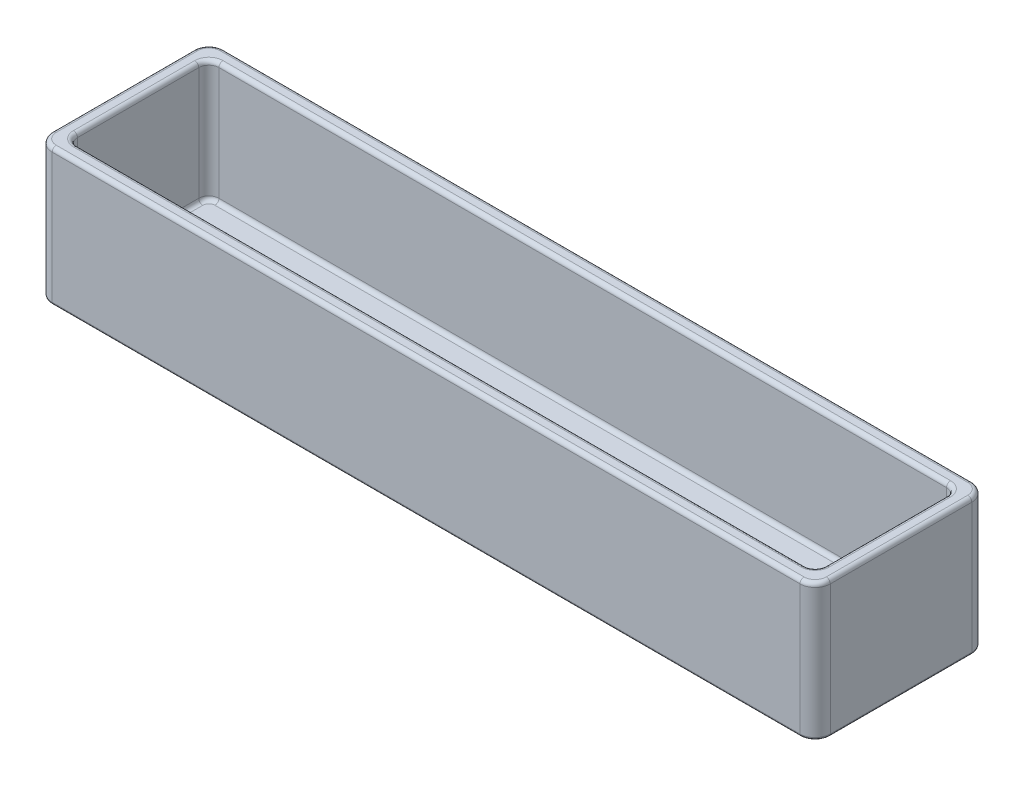
from build123d import *

# Parameters (mm, degrees)
SKETCH1_W           = 244.475
SKETCH1_H           = 53.975
SKETCH1_W_2         = 234.95
SKETCH1_H_2         = 44.45
BOSS_EXTRUDE1_DEPTH = 38.1
SKETCH2_W           = 244.475
SKETCH2_H           = 53.975
BOSS_EXTRUDE2_DEPTH = 4.7625
FILLET1_R           = 3.175
FILLET2_R           = 4.7625
SKETCH4_R           = 12.065
CUT_EXTRUDE2_DEPTH  = 133.316006094
FILLET4_R           = 1.27
FILLET5_R           = 0.762
FILLET6_R           = 1.27
FILLET9_R           = 0.508


with BuildPart() as part:
    # Sketch1 → Boss-Extrude1 (new body)
    with BuildSketch(Plane(origin=(0, 0, 0), x_dir=(1, 0, 0), z_dir=(0, 1, 0))):
        Rectangle(SKETCH1_W, SKETCH1_H)
        Rectangle(SKETCH1_W_2, SKETCH1_H_2, mode=Mode.SUBTRACT)
    extrude(amount=BOSS_EXTRUDE1_DEPTH)

    # Sketch2 → Boss-Extrude2 (add)
    with BuildSketch(Plane.XZ):
        Rectangle(SKETCH2_W, SKETCH2_H)
        with BuildLine():
            ThreePointArc((105.9875, 2.6625), (108.0875, 4.7625), (105.9875, 6.8625))
            ThreePointArc((105.9875, 6.8625), (103.8875, 4.7625), (105.9875, 2.6625))
        make_face(mode=Mode.SUBTRACT)
        with BuildLine():
            ThreePointArc((74.9875, 2.6625), (77.0875, 4.7625), (74.9875, 6.8625))
            ThreePointArc((74.9875, 6.8625), (72.8875, 4.7625), (74.9875, 2.6625))
        make_face(mode=Mode.SUBTRACT)
    extrude(amount=BOSS_EXTRUDE2_DEPTH)

    # Fillet1
    fillet1_edges = [part.edges().sort_by_distance(p)[0] for p in [
        (117.475, 19.05, -22.225),
        (117.475, 19.05, 22.225),
        (-117.475, 19.05, 22.225),
        (-117.475, 19.05, -22.225),
    ]]
    fillet(fillet1_edges, radius=FILLET1_R)

    # Fillet2
    fillet2_edges = [part.edges().sort_by_distance(p)[0] for p in [
        (-122.2375, 16.66875, -26.9875),
        (122.2375, 16.66875, -26.9875),
        (122.2375, 16.66875, 26.9875),
        (-122.2375, 16.66875, 26.9875),
    ]]
    fillet(fillet2_edges, radius=FILLET2_R)

    # Sketch4 → Cut-Extrude2 (cut, through all)
    with BuildSketch(Plane.XZ.offset(4.7625)):
        with Locations((90.4875, 4.7625)):
            Circle(SKETCH4_R)
    extrude(amount=-CUT_EXTRUDE2_DEPTH, mode=Mode.SUBTRACT)

    # Fillet4
    fillet4_edges = [part.edges().sort_by_distance(p)[0] for p in [
        (116.54506403, 0, -21.29506403),
        (117.475, 0, 0),
        (116.54506403, 0, 21.29506403),
        (0, 0, 22.225),
        (-116.54506403, 0, 21.29506403),
        (-117.475, 0, 0),
        (-116.54506403, 0, -21.29506403),
        (0, 0, -22.225),
    ]]
    fillet(fillet4_edges, radius=FILLET4_R)

    # Fillet5
    fillet5_edges = [part.edges().sort_by_distance(p)[0] for p in [
        (-120.842596045, -4.7625, 25.592596045),
        (0, -4.7625, 26.9875),
        (120.842596045, -4.7625, 25.592596045),
        (122.2375, -4.7625, 0),
        (120.842596045, -4.7625, -25.592596045),
        (0, -4.7625, -26.9875),
        (-120.842596045, -4.7625, -25.592596045),
        (-122.2375, -4.7625, 0),
    ]]
    fillet(fillet5_edges, radius=FILLET5_R)

    # Fillet6
    fillet6_edges = [part.edges().sort_by_distance(p)[0] for p in [
        (116.54506403, 38.1, -21.29506403),
        (117.475, 38.1, 0),
        (116.54506403, 38.1, 21.29506403),
        (0, 38.1, 22.225),
        (-116.54506403, 38.1, 21.29506403),
        (-117.475, 38.1, 0),
        (-116.54506403, 38.1, -21.29506403),
        (120.842596045, 38.1, -25.592596045),
        (122.2375, 38.1, 0),
        (120.842596045, 38.1, 25.592596045),
        (0, 38.1, 26.9875),
        (-120.842596045, 38.1, 25.592596045),
        (-122.2375, 38.1, 0),
        (-120.842596045, 38.1, -25.592596045),
        (0, 38.1, -22.225),
        (0, 38.1, -26.9875),
    ]]
    fillet(fillet6_edges, radius=FILLET6_R)

    # Fillet9
    fillet9_edges = [part.edges().sort_by_distance(p)[0] for p in [
        (105.9875, 0, 2.6625),
        (74.9875, 0, 2.6625),
        (78.4225, 0, 4.7625),
    ]]
    fillet(fillet9_edges, radius=FILLET9_R)


solid = part.part
